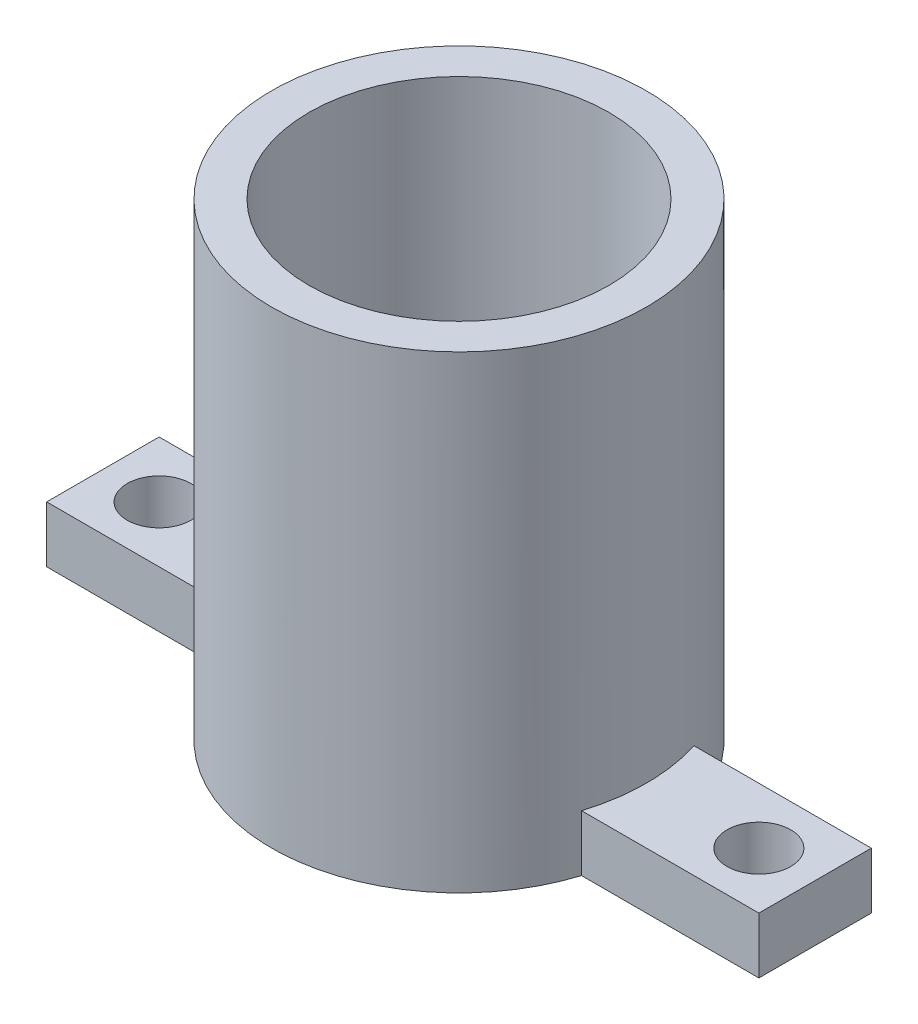
from build123d import *

# Parameters (mm, degrees)
BOSS_EXTRUDE1_DEPTH   = 3
BOSS_EXTRUDE1_2_DEPTH = 3
SKETCH1_3_R           = 8
BOSS_EXTRUDE2_DEPTH   = 25
M3_CLEARANCE_HOLE1_D  = 3.4


with BuildPart() as part:
    # Sketch1 → Boss-Extrude1 (new body)
    with BuildSketch(Plane(origin=(0, 0, 0), x_dir=(1, 0, 0), z_dir=(0, 1, 0))):
        with BuildLine():
            ThreePointArc((28.539392014, 6), (29, 3), (28.539392014, 0))
            Line((28.539392014, 0), (38, 0))
            Line((38, 0), (38, 6))
            Line((38, 6), (28.539392014, 6))
        make_face()
    extrude(amount=BOSS_EXTRUDE1_DEPTH)



with BuildPart() as body_2:
    # Sketch1 → Boss-Extrude1 2 (new body)
    with BuildSketch(Plane(origin=(0, 0, 0), x_dir=(1, 0, 0), z_dir=(0, 1, 0))):
        with BuildLine():
            Line((0, 0), (9.460607986, 0))
            ThreePointArc((9.460607986, 0), (9, 3), (9.460607986, 6))
            Line((9.460607986, 6), (0, 6))
            Line((0, 6), (0, 0))
        make_face()
    extrude(amount=BOSS_EXTRUDE1_2_DEPTH)


with BuildPart() as part_1:
    add(part.part)

    add(body_2.part)  # Boss-Extrude2 merges body 2
    # Sketch1<3> → Boss-Extrude2 (add)
    with BuildSketch(Plane(origin=(0, 0, 0), x_dir=(1, 0, 0), z_dir=(0, 1, 0))):
        with BuildLine():
            ThreePointArc((9.460607986, 0), (19, -7), (28.539392014, 0))
            ThreePointArc((28.539392014, 0), (28.884177258, 1.482423007), (29, 3))
            ThreePointArc((29, 3), (28.884177258, 4.517576993), (28.539392014, 6))
            ThreePointArc((28.539392014, 6), (19, 13), (9.460607986, 6))
            ThreePointArc((9.460607986, 6), (9, 3), (9.460607986, 0))
        make_face()
        with Locations((19, 3)):
            Circle(SKETCH1_3_R, mode=Mode.SUBTRACT)
    extrude(amount=BOSS_EXTRUDE2_DEPTH)

    # M3 Clearance Hole1 (through all)
    with Locations(Plane(origin=(0, 3, 0), x_dir=(1, 0, 0), z_dir=(0, 1, 0))):
        with Locations((3, 3), (35, 3)):
            Hole(M3_CLEARANCE_HOLE1_D / 2)


solid = part_1.part
